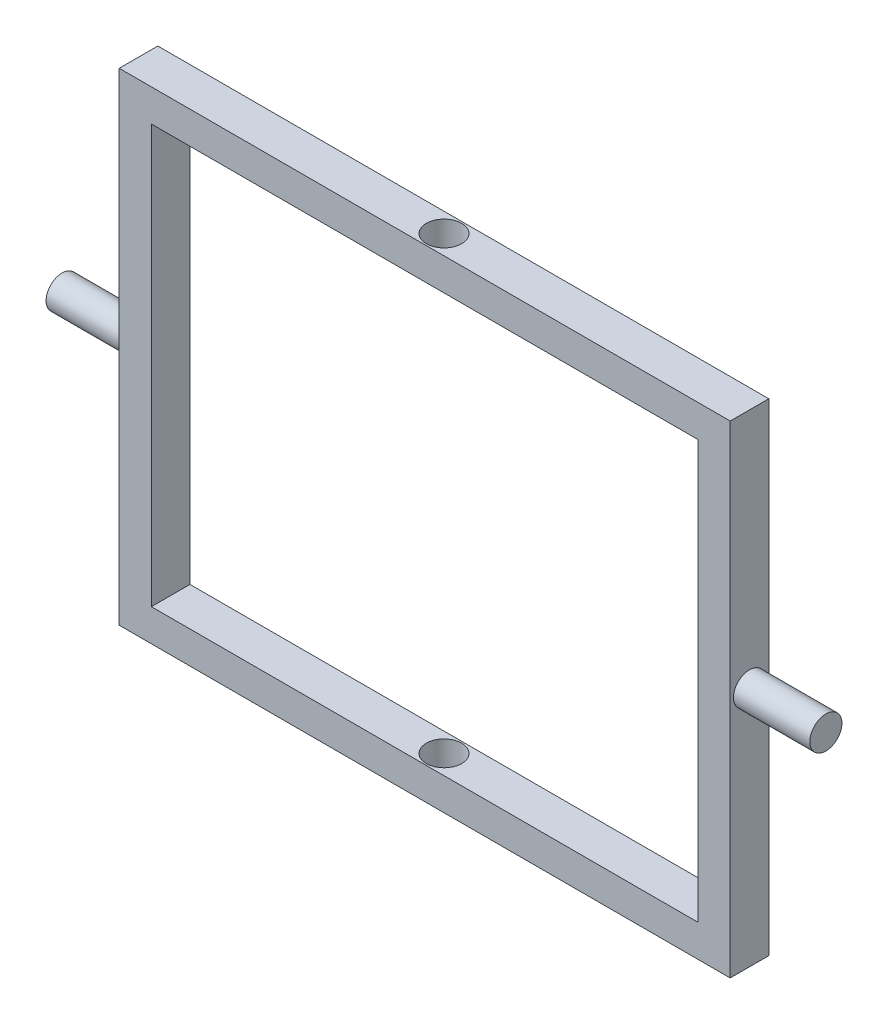
from build123d import *

# Parameters (mm, degrees)
BOSS_EXTRUDE1_DEPTH      = 30
BOSS_EXTRUDE1_DEPTH_BACK = 30
SKETCH1_W                = 950
SKETCH1_H                = 750
SKETCH1_W_2              = 850
SKETCH1_H_2              = 650
SKETCH3_R                = 25
BOSS_EXTRUDE2_DEPTH      = 118.75
SKETCH4_R                = 27.5
CUT_EXTRUDE2_DEPTH       = 85


with BuildPart() as part:
    # Sketch1 → Boss-Extrude1 (new, two sides: drawn at the far end of the back side and taken through both)
    with BuildSketch(Plane.XY.offset(-BOSS_EXTRUDE1_DEPTH_BACK)):
        Rectangle(SKETCH1_W, SKETCH1_H)
        Rectangle(SKETCH1_W_2, SKETCH1_H_2, mode=Mode.SUBTRACT)
    extrude(amount=BOSS_EXTRUDE1_DEPTH + BOSS_EXTRUDE1_DEPTH_BACK)

    # Sketch3 → Boss-Extrude2 (add)
    with BuildSketch(Plane(origin=(475, 0, 0), x_dir=(0, 0, -1), z_dir=(1, 0, 0))):
        Circle(SKETCH3_R)
    boss_extrude2 = extrude(amount=BOSS_EXTRUDE2_DEPTH)

    # Mirror2: Boss-Extrude2 across plane
    add(boss_extrude2.mirror(Plane(origin=(0, 0, 0), x_dir=(0, 0, 1), z_dir=(1, 0, 0))))

    # Sketch4 → Cut-Extrude2 (cut)
    with BuildSketch(Plane.XZ.offset(-325)):
        Circle(SKETCH4_R)
    cut_extrude2 = extrude(amount=-CUT_EXTRUDE2_DEPTH, mode=Mode.SUBTRACT)

    # Mirror3: Cut-Extrude2 across plane
    add(cut_extrude2.mirror(Plane.ZX), mode=Mode.SUBTRACT)


solid = part.part
